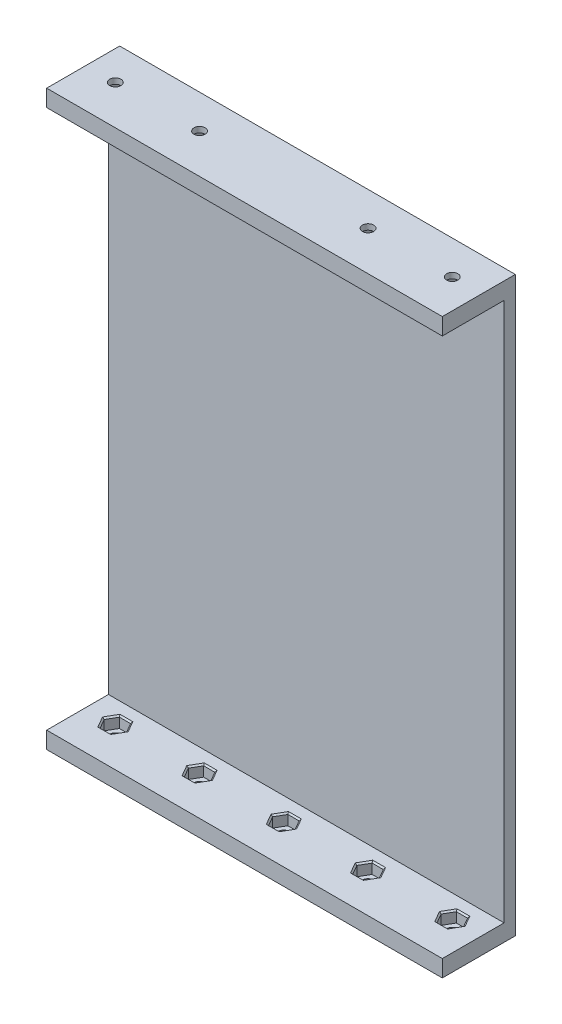
from build123d import *

# Parameters (mm, degrees)
SKETCH1_W               = 140.9
SKETCH1_H               = 204
BOSS_EXTRUDE1_DEPTH     = 4
SKETCH4_W               = 140.9
SKETCH4_H               = 6
BOSS_EXTRUDE3_DEPTH     = 22
CUT_EXTRUDE1_DEPTH      = 217.940550612
CUT_EXTRUDE1_DEPTH_BACK = 217.940550612
SKETCH5_R               = 2
CUT_EXTRUDE4_DEPTH      = 4
SKETCH9_R               = 2
CUT_EXTRUDE5_DEPTH      = 212.308311479
CUT_EXTRUDE6_DEPTH      = 4
CHAMFER1_SIZE           = 0.5


with BuildPart() as part:
    # Sketch1 → Boss-Extrude1 (new body)
    with BuildSketch(Plane.XY):
        Rectangle(SKETCH1_W, SKETCH1_H)
    extrude(amount=-BOSS_EXTRUDE1_DEPTH)

    # Sketch4 → Boss-Extrude3 (add)
    with BuildSketch(Plane.XY):
        with Locations((0, 99)):
            Rectangle(SKETCH4_W, SKETCH4_H)
        with Locations((0, -99)):
            Rectangle(SKETCH4_W, SKETCH4_H)
    extrude(amount=BOSS_EXTRUDE3_DEPTH)

    # Sketch5 → Cut-Extrude1 (cut, two sides: drawn at the far end of the back side and taken through both)
    with BuildSketch(Plane(origin=(0, 102, 0), x_dir=(1, 0, 0), z_dir=(0, 1, 0)).offset(-CUT_EXTRUDE1_DEPTH_BACK)):
        with Locations(Location((-30, -8, 0), (0, 0, 270))):
            Circle(SKETCH5_R)
        with Locations(Location((-60, -8, 0), (0, 0, 270))):
            Circle(SKETCH5_R)
        with Locations(Location((60, -8, 0), (0, 0, 90))):
            Circle(SKETCH5_R)
        with Locations(Location((30, -8, 0), (0, 0, 90))):
            Circle(SKETCH5_R)
    extrude(amount=CUT_EXTRUDE1_DEPTH + CUT_EXTRUDE1_DEPTH_BACK, mode=Mode.SUBTRACT)

    # Sketch8 → Cut-Extrude4 (cut)
    with BuildSketch(Plane(origin=(0, -96, 0), x_dir=(1, 0, 0), z_dir=(0, 1, 0))):
        Polygon((-26.016283143, -8), (-28.008141571, -4.55), (-31.991858429, -4.55), (-33.983716857, -8), (-31.991858429, -11.45), (-28.008141571, -11.45), align=None)
        Polygon((-56.016283143, -8), (-58.008141571, -4.55), (-61.991858429, -4.55), (-63.983716857, -8), (-61.991858429, -11.45), (-58.008141571, -11.45), align=None)
        Polygon((33.983716857, -8), (31.991858429, -4.55), (28.008141571, -4.55), (26.016283143, -8), (28.008141571, -11.45), (31.991858429, -11.45), align=None)
        Polygon((63.983716857, -8), (61.991858429, -4.55), (58.008141571, -4.55), (56.016283143, -8), (58.008141571, -11.45), (61.991858429, -11.45), align=None)
    cut_extrude4 = extrude(amount=-CUT_EXTRUDE4_DEPTH, mode=Mode.SUBTRACT)

    # Mirror1: Cut-Extrude4 across plane
    add(cut_extrude4.mirror(Plane.ZX), mode=Mode.SUBTRACT)

    # Sketch9 → Cut-Extrude5 (cut, through all)
    with BuildSketch(Plane(origin=(0, -96, 0), x_dir=(1, 0, 0), z_dir=(0, 1, 0))):
        with Locations(Location((0, -8, 0), (0, 0, 270))):
            Circle(SKETCH9_R)
    extrude(amount=-CUT_EXTRUDE5_DEPTH, mode=Mode.SUBTRACT)

    # Sketch10 → Cut-Extrude6 (cut)
    with BuildSketch(Plane(origin=(0, -96, 0), x_dir=(1, 0, 0), z_dir=(0, 1, 0))):
        Polygon((1.991858429, -4.55), (-1.991858429, -4.55), (-3.983716857, -8), (-1.991858429, -11.45), (1.991858429, -11.45), (3.983716857, -8), align=None)
    extrude(amount=-CUT_EXTRUDE6_DEPTH, mode=Mode.SUBTRACT)

    # Chamfer1
    chamfer1_edges = [part.edges().sort_by_distance(p)[0] for p in [
        (32.987787643, -96, 9.725),
        (32.987787643, -96, 6.275),
        (30, -96, 4.55),
        (27.012212357, -96, 6.275),
        (27.012212357, -96, 9.725),
        (30, -96, 11.45),
        (62.987787643, -96, 9.725),
        (62.987787643, -96, 6.275),
        (60, -96, 4.55),
        (57.012212357, -96, 6.275),
        (57.012212357, -96, 9.725),
        (60, -96, 11.45),
        (-57.012212357, 96, 9.725),
        (-57.012212357, 96, 6.275),
        (-60, 96, 4.55),
        (-62.987787643, 96, 6.275),
        (-62.987787643, 96, 9.725),
        (-60, 96, 11.45),
        (-27.012212357, 96, 9.725),
        (-27.012212357, 96, 6.275),
        (-30, 96, 4.55),
        (-32.987787643, 96, 6.275),
        (-32.987787643, 96, 9.725),
        (-30, 96, 11.45),
        (32.987787643, 96, 9.725),
        (32.987787643, 96, 6.275),
        (30, 96, 4.55),
        (27.012212357, 96, 6.275),
        (27.012212357, 96, 9.725),
        (30, 96, 11.45),
        (62.987787643, 96, 9.725),
        (62.987787643, 96, 6.275),
        (60, 96, 4.55),
        (57.012212357, 96, 6.275),
        (57.012212357, 96, 9.725),
        (60, 96, 11.45),
        (2.987787643, -96, 6.275),
        (0, -96, 4.55),
        (-2.987787643, -96, 6.275),
        (-2.987787643, -96, 9.725),
        (0, -96, 11.45),
        (2.987787643, -96, 9.725),
        (-57.012212357, -96, 9.725),
        (-57.012212357, -96, 6.275),
        (-60, -96, 4.55),
        (-62.987787643, -96, 6.275),
        (-62.987787643, -96, 9.725),
        (-60, -96, 11.45),
        (-27.012212357, -96, 9.725),
        (-27.012212357, -96, 6.275),
        (-30, -96, 4.55),
        (-32.987787643, -96, 6.275),
        (-32.987787643, -96, 9.725),
        (-30, -96, 11.45),
    ]]
    chamfer(chamfer1_edges, length=CHAMFER1_SIZE)


solid = part.part
